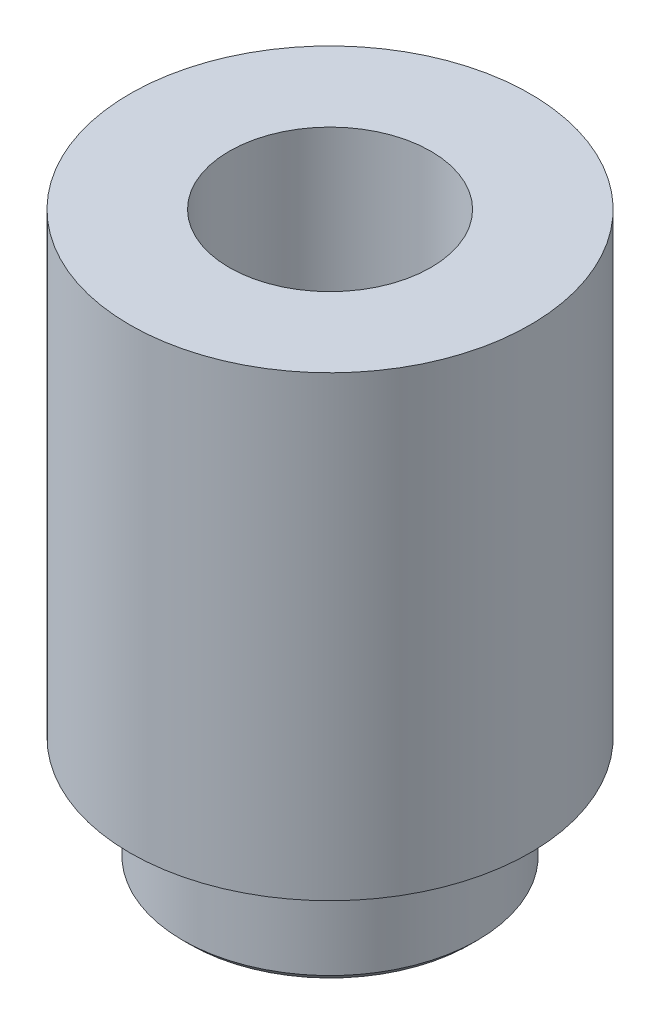
from build123d import *
from build123d.topology import SkipClean

# Parameters (mm, degrees)
SKETCH1_R           = 2.78
SKETCH1_R_2         = 1.4
BOSS_EXTRUDE1_DEPTH = 6.35
BOSS_EXTRUDE2_START = 1.52
SKETCH2_R           = 2.045
SKETCH2_R_2         = 1.4
BOSS_EXTRUDE2_DEPTH = 1.52
CHAMFER1_SIZE       = 0.1


with BuildPart() as part:
    # Sketch1 → Boss-Extrude1 (new body)
    with BuildSketch(Plane(origin=(0, 0, 0), x_dir=(1, 0, 0), z_dir=(0, 1, 0))):
        with Locations(Location((0, 0, 0), (0, 0, 270))):
            Circle(SKETCH1_R)
        with Locations(Location((0, 0, 0), (0, 0, 270))):
            Circle(SKETCH1_R_2, mode=Mode.SUBTRACT)
    extrude(amount=BOSS_EXTRUDE1_DEPTH)

    # Sketch2 → Boss-Extrude2 (add)
    with SkipClean():  # the faces are left unmerged after this step: merging them gives an invalid solid
        with BuildSketch(Plane.XZ.offset(BOSS_EXTRUDE2_START)):
            with Locations(Location((0, 0, 0), (0, 0, 90))):
                Circle(SKETCH2_R)
            with Locations(Location((0, 0, 0), (0, 0, 270))):
                Circle(SKETCH2_R_2, mode=Mode.SUBTRACT)
        extrude(amount=-BOSS_EXTRUDE2_DEPTH)

    # Chamfer1
    chamfer1_edges = [part.edges().sort_by_distance(p)[0] for p in [
        (0, -1.52, -2.045),
    ]]
    chamfer(chamfer1_edges, length=CHAMFER1_SIZE)


solid = part.part
